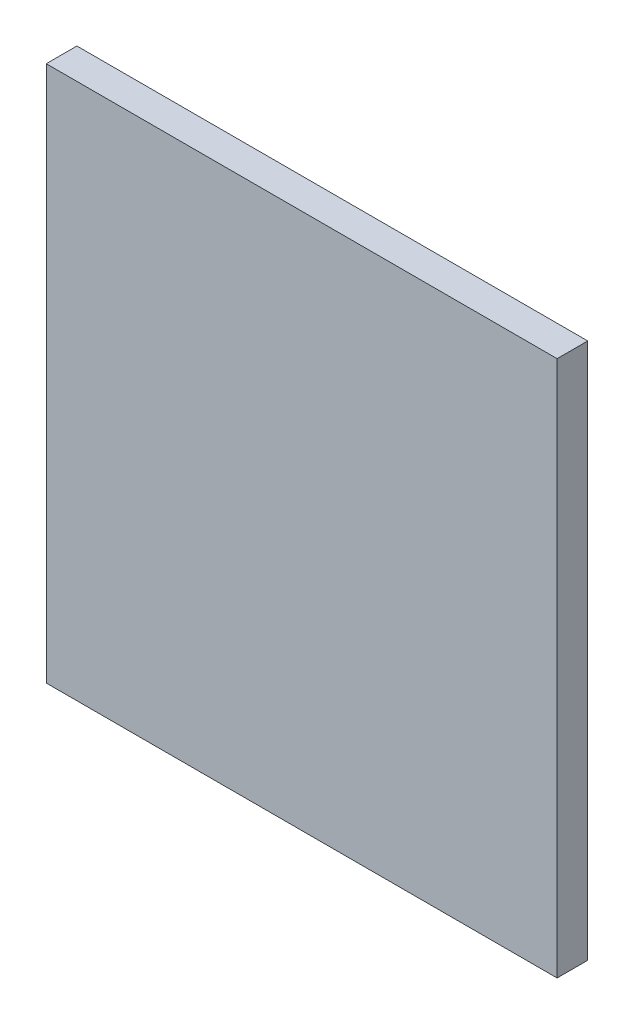
from build123d import *

# Parameters (mm, degrees)
SKETCH1_W           = 30
SKETCH1_H           = 31.5
BOSS_EXTRUDE1_DEPTH = 1.8


with BuildPart() as part:
    # Sketch1 → Boss-Extrude1 (new body)
    with BuildSketch(Plane.XY):
        Rectangle(SKETCH1_W, SKETCH1_H)
    extrude(amount=BOSS_EXTRUDE1_DEPTH)


solid = part.part
